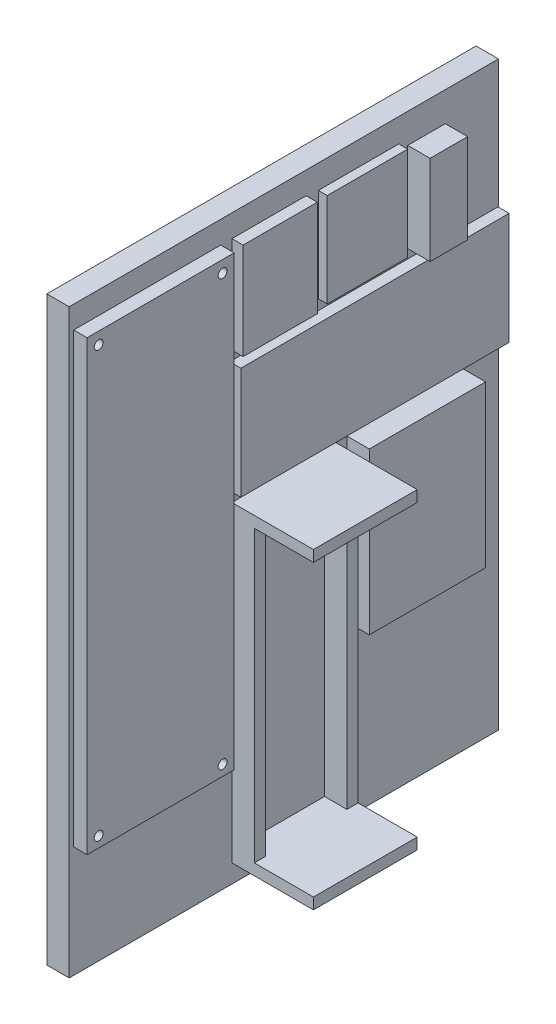
from build123d import *

# Parameters (mm, degrees)
SKETCH1_W            = 96
SKETCH1_H            = 130
SKETCH1_W_2          = 32.89
SKETCH1_H_2          = 100.13
SKETCH1_R            = 1
BOSS_EXTRUDE1_DEPTH  = 5
SKETCH3_W            = 32.89
SKETCH3_H            = 100.13
SKETCH3_R            = 1
BOSS_EXTRUDE3_DEPTH  = 3
SKETCH4_W            = 16.6
SKETCH4_H            = 21.6
BOSS_EXTRUDE4_DEPTH  = 2.5
SKETCH5_W            = 60
SKETCH5_H            = 25
BOSS_EXTRUDE5_DEPTH  = 2.5
SKETCH6_W            = 18
SKETCH6_H            = 21
BOSS_EXTRUDE6_DEPTH  = 2
SKETCH7_W            = 8.4
SKETCH7_H            = 20
BOSS_EXTRUDE7_DEPTH  = 5
SKETCH9_W            = 2.5
SKETCH9_H            = 64.8
BOSS_EXTRUDE8_DEPTH  = 5
SKETCH10_W           = 23.22
SKETCH10_H           = 2.5
BOSS_EXTRUDE9_DEPTH  = 18.22
SKETCH12_W           = 26
SKETCH12_H           = 36
BOSS_EXTRUDE11_DEPTH = 5
SKETCH11_W           = 26
SKETCH11_H           = 36
BOSS_EXTRUDE10_DEPTH = 5


with BuildPart() as part:
    # Sketch1 → Boss-Extrude1 (new body)
    # profile 1 of 2: a face of its own
    with BuildSketch(Plane(origin=(0, 0, 0), x_dir=(0, 0, -1), z_dir=(1, 0, 0))):
        with Locations((30.555, -9.935)):
            Rectangle(SKETCH1_W, SKETCH1_H)
        Rectangle(SKETCH1_W_2, SKETCH1_H_2, mode=Mode.SUBTRACT)
    # profile 2 of 2: a face of its own
    with BuildSketch(Plane(origin=(0, 0, 0), x_dir=(0, 0, -1), z_dir=(1, 0, 0))):
        Rectangle(SKETCH1_W_2, SKETCH1_H_2)
        with Locations((-13.855, -47.705)):
            Circle(SKETCH1_R, mode=Mode.SUBTRACT)
        with Locations((13.855, -47.705)):
            Circle(SKETCH1_R, mode=Mode.SUBTRACT)
        with Locations((13.855, 47.395)):
            Circle(SKETCH1_R, mode=Mode.SUBTRACT)
        with Locations((-13.855, 47.395)):
            Circle(SKETCH1_R, mode=Mode.SUBTRACT)
    extrude(amount=BOSS_EXTRUDE1_DEPTH)

    # Sketch3 → Boss-Extrude3 (add)
    with BuildSketch(Plane(origin=(5, 0, 0), x_dir=(0, 0, -1), z_dir=(1, 0, 0))):
        Rectangle(SKETCH3_W, SKETCH3_H)
        with Locations((-13.855, 47.395)):
            Circle(SKETCH3_R, mode=Mode.SUBTRACT)
        with Locations((13.855, 47.395)):
            Circle(SKETCH3_R, mode=Mode.SUBTRACT)
        with Locations((13.855, -47.705)):
            Circle(SKETCH3_R, mode=Mode.SUBTRACT)
        with Locations((-13.855, -47.705)):
            Circle(SKETCH3_R, mode=Mode.SUBTRACT)
    extrude(amount=BOSS_EXTRUDE3_DEPTH)

    # Sketch4 → Boss-Extrude4 (add)
    with BuildSketch(Plane(origin=(5, 0, 0), x_dir=(0, 0, -1), z_dir=(1, 0, 0))):
        with Locations((27.245, 39.265)):
            Rectangle(SKETCH4_W, SKETCH4_H)
    extrude(amount=BOSS_EXTRUDE4_DEPTH)

    # Sketch5 → Boss-Extrude5 (add)
    with BuildSketch(Plane(origin=(5, 0, 0), x_dir=(0, 0, -1), z_dir=(1, 0, 0))):
        with Locations((48.445, 13.965)):
            Rectangle(SKETCH5_W, SKETCH5_H)
    extrude(amount=BOSS_EXTRUDE5_DEPTH)

    # Sketch6 → Boss-Extrude6 (add)
    with BuildSketch(Plane(origin=(5, 0, 0), x_dir=(0, 0, -1), z_dir=(1, 0, 0))):
        with Locations((47.260487744, 39.246233232)):
            Rectangle(SKETCH6_W, SKETCH6_H)
    extrude(amount=BOSS_EXTRUDE6_DEPTH)

    # Sketch7 → Boss-Extrude7 (add)
    with BuildSketch(Plane(origin=(5, 0, 0), x_dir=(0, 0, -1), z_dir=(1, 0, 0))):
        with Locations((62.460487744, 38.465)):
            Rectangle(SKETCH7_W, SKETCH7_H)
    extrude(amount=BOSS_EXTRUDE7_DEPTH)

    # Sketch9 → Boss-Extrude8 (add)
    with BuildSketch(Plane(origin=(5, 0, 0), x_dir=(0, 0, -1), z_dir=(1, 0, 0))):
        with Locations((20.195, -35.935)):
            Rectangle(SKETCH9_W, SKETCH9_H)
        with Locations((40.915, -35.935)):
            Rectangle(SKETCH9_W, SKETCH9_H)
    extrude(amount=BOSS_EXTRUDE8_DEPTH)

    # Sketch10 → Boss-Extrude9 (add)
    with BuildSketch(Plane(origin=(5, 0, 0), x_dir=(0, 0, -1), z_dir=(1, 0, 0))):
        with Locations((30.555, -69.585)):
            Rectangle(SKETCH10_W, SKETCH10_H)
        with Locations((30.555, -2.285)):
            Rectangle(SKETCH10_W, SKETCH10_H)
    extrude(amount=BOSS_EXTRUDE9_DEPTH)

    # Sketch12 → Boss-Extrude11 (add)
    with BuildSketch(Plane(origin=(5, 0, 0), x_dir=(0, 0, -1), z_dir=(1, 0, 0))):
        with Locations((57.665, -19.035)):
            Rectangle(SKETCH12_W, SKETCH12_H)
    extrude(amount=BOSS_EXTRUDE11_DEPTH)

    # Sketch11 → Boss-Extrude10 (add)
    with BuildSketch(Plane(origin=(5, 0, 0), x_dir=(0, 0, -1), z_dir=(1, 0, 0))):
        with Locations((57.665, -19.035)):
            Rectangle(SKETCH11_W, SKETCH11_H)
    extrude(amount=BOSS_EXTRUDE10_DEPTH)


solid = part.part
